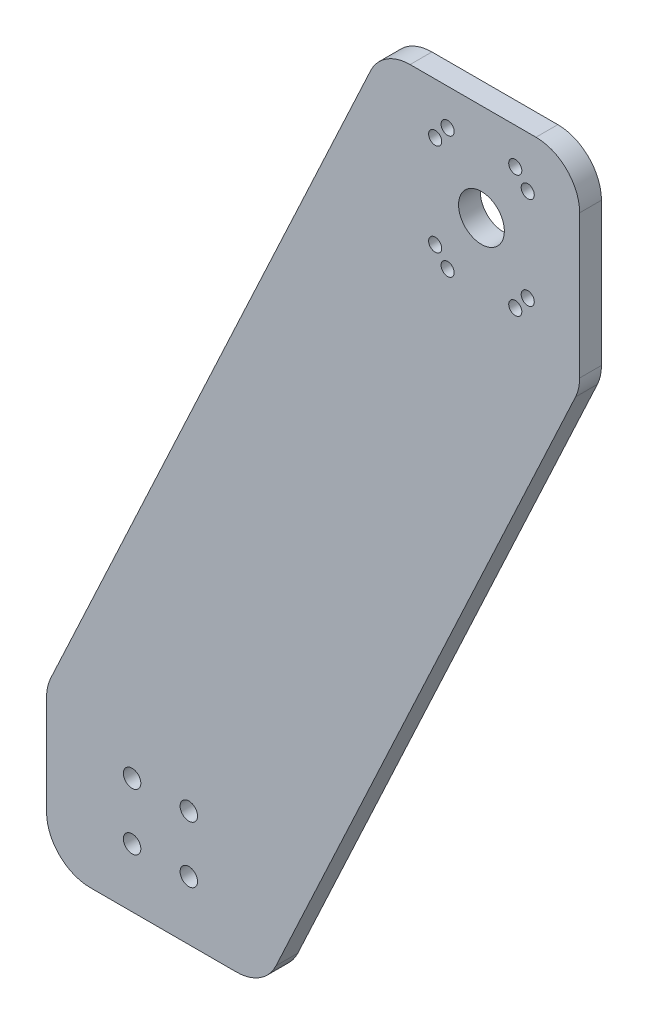
from build123d import *

# Parameters (mm, degrees)
SCHIZZO1_R                   = 4
SCHIZZO1_R_2                 = 10.5
SCHIZZO1_R_3                 = 3
ESTRUSIONE_ESTRUSIONE2_DEPTH = 10
SCHIZZO2_R                   = 2
TAGLIO_ESTRUSIONE1_DEPTH     = 15


with BuildPart() as part:
    # Schizzo1 → Estrusione-Estrusione2 (new body)
    with BuildSketch(Plane.XY):
        with BuildLine():
            Line((20, 0), (87.022408988, 0))
            ThreePointArc((87.022408988, 0), (97.768401155, 3.132171084), (105.148564729, 11.547634765))
            Line((105.148564729, 11.547634765), (242.445343973, 305.981528018))
            ThreePointArc((242.445343973, 305.981528018), (243.845108375, 310.105100974), (244.319188233, 314.433893253))
            Line((244.319188233, 314.433893253), (244.319188233, 380))
            ThreePointArc((244.319188233, 380), (238.461323856, 394.142135624), (224.319188233, 400))
            Line((224.319188233, 400), (166.622932407, 400))
            ThreePointArc((166.622932407, 400), (155.87694024, 396.867828916), (148.496776667, 388.452365235))
            Line((148.496776667, 388.452365235), (1.873844259, 74.018471982))
            ThreePointArc((1.873844259, 74.018471982), (0.474079858, 69.894899026), (0, 65.566106747))
            Line((0, 65.566106747), (0, 20))
            ThreePointArc((0, 20), (5.857864376, 5.857864376), (20, 0))
        make_face()
        with Locations((39.213445393, 53)):
            Circle(SCHIZZO1_R, mode=Mode.SUBTRACT)
        with Locations(Location((65.213445393, 53, 0), (0, 0, 180))):
            Circle(SCHIZZO1_R, mode=Mode.SUBTRACT)
        with Locations((65.213445393, 27)):
            Circle(SCHIZZO1_R, mode=Mode.SUBTRACT)
        with Locations(Location((39.213445393, 27, 0), (0, 0, 180))):
            Circle(SCHIZZO1_R, mode=Mode.SUBTRACT)
        with Locations((199.319188233, 355.469283566)):
            Circle(SCHIZZO1_R_2, mode=Mode.SUBTRACT)
        with Locations((183.819188233, 383.469283566)):
            Circle(SCHIZZO1_R_3, mode=Mode.SUBTRACT)
        with Locations((214.819188233, 383.469283566)):
            Circle(SCHIZZO1_R_3, mode=Mode.SUBTRACT)
        with Locations((220.532391668, 376.682487002)):
            Circle(SCHIZZO1_R_3, mode=Mode.SUBTRACT)
        with Locations((220.532391668, 334.256080131)):
            Circle(SCHIZZO1_R_3, mode=Mode.SUBTRACT)
        with Locations((214.819188233, 327.469283566)):
            Circle(SCHIZZO1_R_3, mode=Mode.SUBTRACT)
        with Locations((183.819188233, 327.469283566)):
            Circle(SCHIZZO1_R_3, mode=Mode.SUBTRACT)
        with Locations((178.105984797, 334.256080131)):
            Circle(SCHIZZO1_R_3, mode=Mode.SUBTRACT)
        with Locations((178.105984797, 376.682487002)):
            Circle(SCHIZZO1_R_3, mode=Mode.SUBTRACT)
    extrude(amount=-ESTRUSIONE_ESTRUSIONE2_DEPTH)

    # Schizzo2 → Taglio-Estrusione1 (cut)
    with BuildSketch(Plane.XZ):
        with Locations((53.511204494, -5)):
            Circle(SCHIZZO2_R)
        with Locations((81.011204494, -5)):
            Circle(SCHIZZO2_R)
        with Locations(Location((26.011204494, -5, 0), (0, 0, 180))):
            Circle(SCHIZZO2_R)
    extrude(amount=-TAGLIO_ESTRUSIONE1_DEPTH, mode=Mode.SUBTRACT)


solid = part.part
